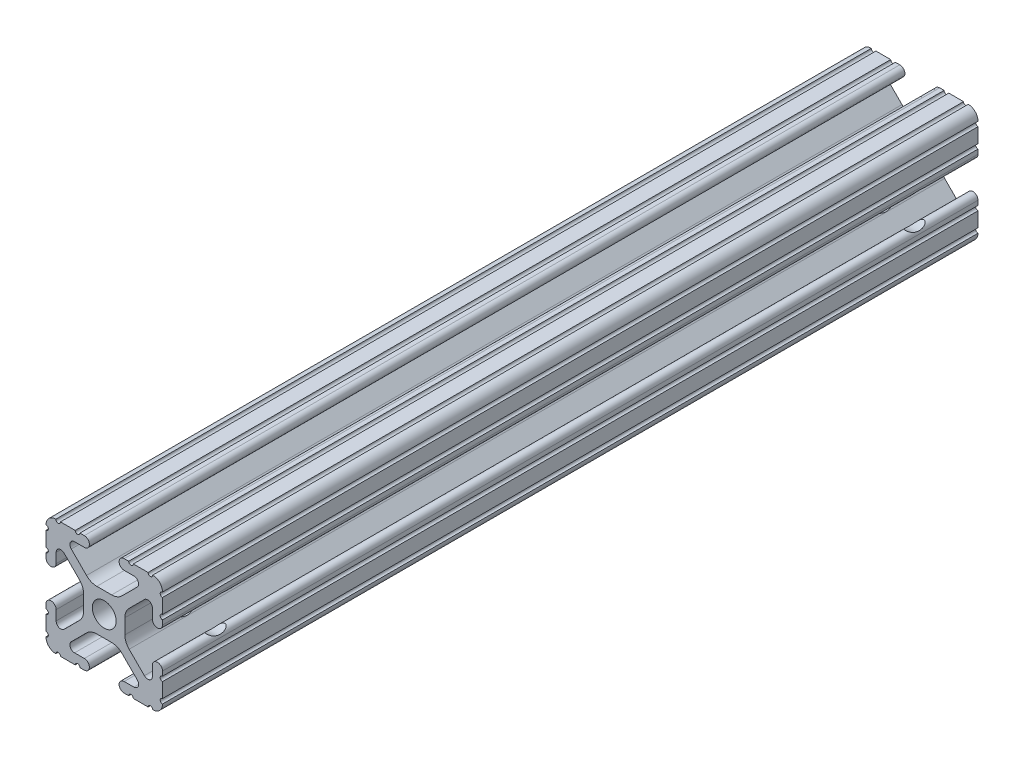
from build123d import *

# Parameters (mm, degrees)
SKETCH1_R           = 2.6035
BOSS_EXTRUDE1_DEPTH = 177.8
CUT_EXTRUDE1_REACH  = 207.175
SKETCH3_R           = 3.81


with BuildPart() as part:
    # Sketch1 → Boss-Extrude1 (new body)
    with BuildSketch(Plane(origin=(0, 0, -25.4), x_dir=(-1, 0, 0), z_dir=(0, 0, -1))):
        with BuildLine():
            Line((12.7, -9.5504), (12.7, -6.3330836))
            ThreePointArc((12.7, -6.3330836), (12.192, -5.8250836), (12.7, -5.3170836))
            Line((12.7, -5.3170836), (12.7, -4.3434))
            ThreePointArc((12.7, -4.3434), (11.5951, -3.2385), (10.4902, -4.3434))
            Line((10.4902, -4.3434), (10.4902, -6.474794456))
            ThreePointArc((10.4902, -6.474794456), (9.863006367, -7.413456061), (8.75577951, -7.193214945))
            Line((8.75577951, -7.193214945), (5.42573597, -3.863171405))
            ThreePointArc((5.42573597, -3.863171405), (4.737482484, -2.833127272), (4.4958, -1.618107374))
            Line((4.4958, -1.618107374), (4.4958, 1.618107374))
            ThreePointArc((4.4958, 1.618107374), (4.737482484, 2.833127272), (5.42573597, 3.863171405))
            Line((5.42573597, 3.863171405), (8.75577951, 7.193214945))
            ThreePointArc((8.75577951, 7.193214945), (9.863006367, 7.413456061), (10.4902, 6.474794456))
            Line((10.4902, 6.474794456), (10.4902, 4.343399971))
            ThreePointArc((10.4902, 4.343399971), (11.5951, 3.238499971), (12.7, 4.343399971))
            Line((12.7, 4.343399971), (12.7, 5.3170836))
            ThreePointArc((12.7, 5.3170836), (12.192, 5.8250836), (12.7, 6.3330836))
            Line((12.7, 6.3330836), (12.7, 9.5504))
            ThreePointArc((12.7, 9.5504), (12.192000006, 10.058323491), (12.699846982, 10.566399977))
            ThreePointArc((12.699846982, 10.566399977), (12.082522516, 12.082522516), (10.566399977, 12.699846982))
            ThreePointArc((10.566399977, 12.699846982), (10.058323491, 12.192000006), (9.5504, 12.7))
            Line((9.5504, 12.7), (6.3330836, 12.7))
            ThreePointArc((6.3330836, 12.7), (5.8250836, 12.192), (5.3170836, 12.7))
            Line((5.3170836, 12.7), (4.3434, 12.7))
            ThreePointArc((4.3434, 12.7), (3.2385, 11.5951), (4.3434, 10.4902))
            Line((4.3434, 10.4902), (6.474794456, 10.4902))
            ThreePointArc((6.474794456, 10.4902), (7.413456061, 9.863006367), (7.193214945, 8.75577951))
            Line((7.193214945, 8.75577951), (3.863171405, 5.42573597))
            ThreePointArc((3.863171405, 5.42573597), (2.833127272, 4.737482484), (1.618107374, 4.4958))
            Line((1.618107374, 4.4958), (-1.618107374, 4.4958))
            ThreePointArc((-1.618107374, 4.4958), (-2.833127272, 4.737482484), (-3.863171405, 5.42573597))
            Line((-3.863171405, 5.42573597), (-7.193214945, 8.75577951))
            ThreePointArc((-7.193214945, 8.75577951), (-7.413456061, 9.863006367), (-6.474794456, 10.4902))
            Line((-6.474794456, 10.4902), (-4.343399971, 10.4902))
            ThreePointArc((-4.343399971, 10.4902), (-3.238499971, 11.5951), (-4.343399971, 12.7))
            Line((-4.343399971, 12.7), (-5.3170836, 12.7))
            ThreePointArc((-5.3170836, 12.7), (-5.8250836, 12.192), (-6.3330836, 12.7))
            Line((-6.3330836, 12.7), (-9.5504, 12.7))
            ThreePointArc((-9.5504, 12.7), (-10.058323491, 12.192000006), (-10.566399977, 12.699846982))
            ThreePointArc((-10.566399977, 12.699846982), (-12.082522516, 12.082522516), (-12.699846982, 10.566399977))
            ThreePointArc((-12.699846982, 10.566399977), (-12.192000006, 10.058323491), (-12.7, 9.5504))
            Line((-12.7, 9.5504), (-12.7, 6.3330836))
            ThreePointArc((-12.7, 6.3330836), (-12.192, 5.8250836), (-12.7, 5.3170836))
            Line((-12.7, 5.3170836), (-12.7, 4.3434))
            ThreePointArc((-12.7, 4.3434), (-11.5951, 3.2385), (-10.4902, 4.3434))
            Line((-10.4902, 4.3434), (-10.4902, 6.474794456))
            ThreePointArc((-10.4902, 6.474794456), (-9.863006367, 7.413456061), (-8.75577951, 7.193214945))
            Line((-8.75577951, 7.193214945), (-5.42573597, 3.863171405))
            ThreePointArc((-5.42573597, 3.863171405), (-4.737482484, 2.833127272), (-4.4958, 1.618107374))
            Line((-4.4958, 1.618107374), (-4.4958, -1.618107374))
            ThreePointArc((-4.4958, -1.618107374), (-4.737482484, -2.833127272), (-5.42573597, -3.863171405))
            Line((-5.42573597, -3.863171405), (-8.75577951, -7.193214945))
            ThreePointArc((-8.75577951, -7.193214945), (-9.863006367, -7.413456061), (-10.4902, -6.474794456))
            Line((-10.4902, -6.474794456), (-10.4902, -4.343399971))
            ThreePointArc((-10.4902, -4.343399971), (-11.5951, -3.238499971), (-12.7, -4.343399971))
            Line((-12.7, -4.343399971), (-12.7, -5.3170836))
            ThreePointArc((-12.7, -5.3170836), (-12.192, -5.8250836), (-12.7, -6.3330836))
            Line((-12.7, -6.3330836), (-12.7, -9.5504))
            ThreePointArc((-12.7, -9.5504), (-12.192000006, -10.058323491), (-12.699846982, -10.566399977))
            ThreePointArc((-12.699846982, -10.566399977), (-12.082522516, -12.082522516), (-10.566399977, -12.699846982))
            ThreePointArc((-10.566399977, -12.699846982), (-10.058323491, -12.192000006), (-9.5504, -12.7))
            Line((-9.5504, -12.7), (-6.3330836, -12.7))
            ThreePointArc((-6.3330836, -12.7), (-5.8250836, -12.192), (-5.3170836, -12.7))
            Line((-5.3170836, -12.7), (-4.3434, -12.7))
            ThreePointArc((-4.3434, -12.7), (-3.2385, -11.5951), (-4.3434, -10.4902))
            Line((-4.3434, -10.4902), (-6.474794456, -10.4902))
            ThreePointArc((-6.474794456, -10.4902), (-7.413456061, -9.863006367), (-7.193214945, -8.75577951))
            Line((-7.193214945, -8.75577951), (-3.863171405, -5.42573597))
            ThreePointArc((-3.863171405, -5.42573597), (-2.833127272, -4.737482484), (-1.618107374, -4.4958))
            Line((-1.618107374, -4.4958), (1.618107374, -4.4958))
            ThreePointArc((1.618107374, -4.4958), (2.833127272, -4.737482484), (3.863171405, -5.42573597))
            Line((3.863171405, -5.42573597), (7.193214945, -8.75577951))
            ThreePointArc((7.193214945, -8.75577951), (7.413456061, -9.863006367), (6.474794456, -10.4902))
            Line((6.474794456, -10.4902), (4.343399971, -10.4902))
            ThreePointArc((4.343399971, -10.4902), (3.238499971, -11.5951), (4.343399971, -12.7))
            Line((4.343399971, -12.7), (5.3170836, -12.7))
            ThreePointArc((5.3170836, -12.7), (5.8250836, -12.192), (6.3330836, -12.7))
            Line((6.3330836, -12.7), (9.5504, -12.7))
            ThreePointArc((9.5504, -12.7), (10.058323491, -12.192000006), (10.566399977, -12.699846982))
            ThreePointArc((10.566399977, -12.699846982), (12.082522516, -12.082522516), (12.699846982, -10.566399977))
            ThreePointArc((12.699846982, -10.566399977), (12.192000006, -10.058323491), (12.7, -9.5504))
        make_face()
        with Locations(Location((0, 0, 0), (0, 0, 180))):
            Circle(SKETCH1_R, mode=Mode.SUBTRACT)
    extrude(amount=BOSS_EXTRUDE1_DEPTH)

    # Cut-Extrude1: up to this face of the body (flat: up to its plane)
    cut_extrude1_end = Plane(part.part.faces().sort_by_distance((-12.7, 7.9417418, -114.3))[0])
    # Sketch3 → Cut-Extrude1 (cut, up to the picked face)
    with BuildSketch(Plane(origin=(12.7, 0, 0), x_dir=(0, 0, -1), z_dir=(1, 0, 0)), mode=Mode.PRIVATE) as cut_extrude1_sk1:
        with Locations(Location((38.099847092, 0, 0), (0, 0, 334.868317911))):
            Circle(SKETCH3_R)
    cut_extrude1_tool1 = split(extrude(cut_extrude1_sk1.sketch, amount=-CUT_EXTRUDE1_REACH, mode=Mode.PRIVATE), bisect_by=cut_extrude1_end, keep=Keep.BOTH, mode=Mode.PRIVATE)
    # Sketch3 → Cut-Extrude1 (cut, up to the picked face)
    with BuildSketch(Plane(origin=(12.7, 0, 0), x_dir=(0, 0, -1), z_dir=(1, 0, 0)), mode=Mode.PRIVATE) as cut_extrude1_sk2:
        with Locations(Location((190.500152908, 0, 0), (0, 0, 25.131682089))):
            Circle(SKETCH3_R)
    cut_extrude1_tool2 = split(extrude(cut_extrude1_sk2.sketch, amount=-CUT_EXTRUDE1_REACH, mode=Mode.PRIVATE), bisect_by=cut_extrude1_end, keep=Keep.BOTH, mode=Mode.PRIVATE)
    add(cut_extrude1_tool1.solids().sort_by(Axis((12.7, 0, -38.099847), (-1, 0, 0)))[0], mode=Mode.SUBTRACT)
    add(cut_extrude1_tool2.solids().sort_by(Axis((12.7, 0, -190.500153), (-1, 0, 0)))[0], mode=Mode.SUBTRACT)


solid = part.part
